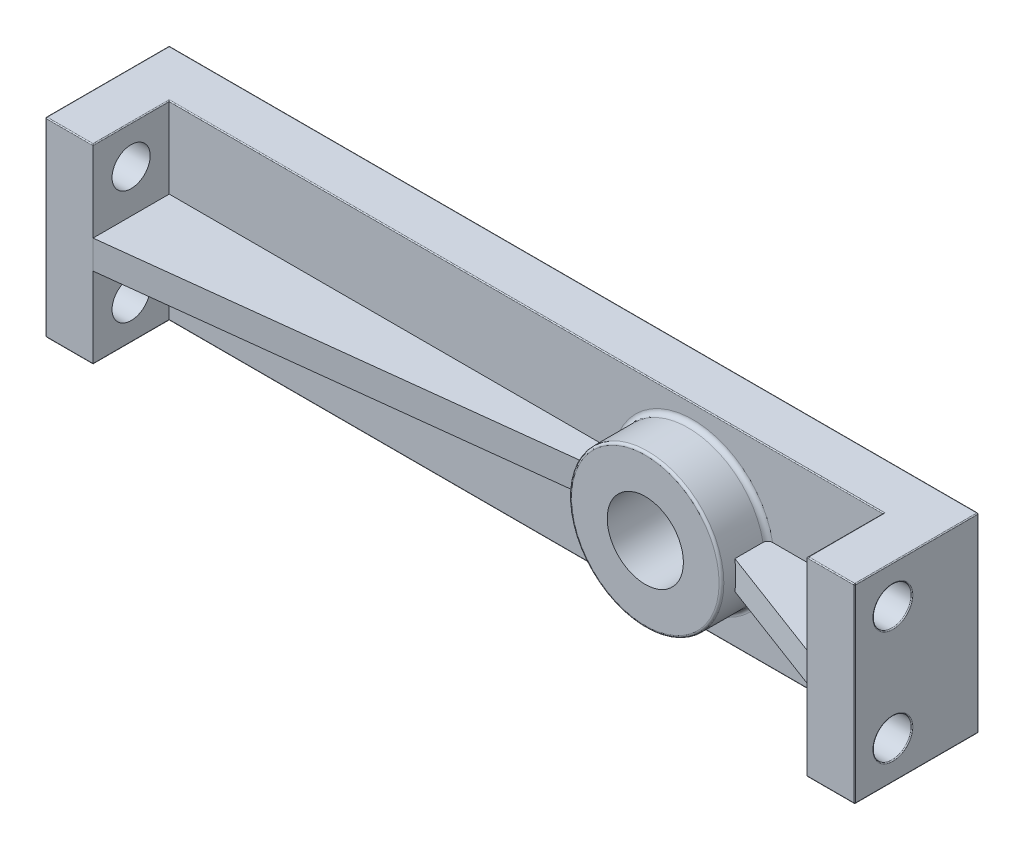
from build123d import *

# Parameters (mm, degrees)
BOSS_EXTRUDE1_DEPTH  = 254
BOSS_EXTRUDE2_DEPTH  = 38.1
SKETCH4_R            = 101.6
CUT_EXTRUDE1_DEPTH   = 1128.442455294
BOSS_EXTRUDE11_REACH = 1129.442
BOSS_EXTRUDE12_REACH = 1129.442
SKETCH12_R           = 101.6
BOSS_EXTRUDE13_DEPTH = 127
CUT_EXTRUDE3_START   = -127
SKETCH19_R           = 50.8
CUT_EXTRUDE3_DEPTH   = 127
SKETCH21_R           = 50.8
CUT_EXTRUDE4_DEPTH   = 127
FILLET1_R            = 2.54
FILLET2_R            = 6.35
FILLET3_R            = 12.7


with BuildPart() as part:
    # Sketch1 → Boss-Extrude1 (new, symmetric)
    with BuildSketch(Plane(origin=(0, 0, 0), x_dir=(1, 0, 0), z_dir=(0, 1, 0))):
        Polygon((-952.5, 0), (952.5, 0), (952.5, -203.2), (1079.5, -203.2), (1079.5, 127), (-1079.5, 127), (-1079.5, -203.2), (-952.5, -203.2), align=None)
    extrude(amount=BOSS_EXTRUDE1_DEPTH, both=True)

    # Sketch2 → Boss-Extrude2 (add, symmetric)
    with BuildSketch(Plane(origin=(0, 0, 0), x_dir=(1, 0, 0), z_dir=(0, 1, 0))):
        Polygon((-952.5, -203.2), (-952.5, 0), (241.3, 0), (241.3, -63.5), align=None)
        Polygon((952.5, 0), (952.5, -203.2), (647.7, -88.9), (647.7, 0), align=None)
    extrude(amount=BOSS_EXTRUDE2_DEPTH, both=True)

    # Sketch4 → Cut-Extrude1 (cut, through all)
    with BuildSketch(Plane.XY):
        with Locations((444.5, 0)):
            Circle(SKETCH4_R)
    extrude(amount=-CUT_EXTRUDE1_DEPTH, mode=Mode.SUBTRACT)

    # Boss-Extrude11: up to this plane
    boss_extrude11_end = Plane(origin=(-952.5, 38.1, 203.2), z_dir=(-0.11622816949504458, 0, -0.9932225393212899))
    # Sketch10 → Boss-Extrude11 (add, up to the surface)
    with BuildSketch(Plane.XY, mode=Mode.PRIVATE) as boss_extrude11_sk1:
        with BuildLine():
            Line((244.903832702, 38.1), (241.3, 38.1))
            Line((241.3, 38.1), (241.3, -8.24e-07))
            ThreePointArc((241.3, -8.24e-07), (242.202964398, 19.135030359), (244.903832702, 38.1))
        make_face()
    boss_extrude11_tool1 = split(extrude(boss_extrude11_sk1.sketch, amount=BOSS_EXTRUDE11_REACH, mode=Mode.PRIVATE), bisect_by=boss_extrude11_end, keep=Keep.BOTH, mode=Mode.PRIVATE)
    add(boss_extrude11_tool1.solids().sort_by_distance((242.379486, 28.591974, 0))[0])
    # Sketch10 → Boss-Extrude11 (add, up to the surface)
    with BuildSketch(Plane.XY, mode=Mode.PRIVATE) as boss_extrude11_sk2:
        with BuildLine():
            ThreePointArc((244.903832702, -38.1), (242.202964476, -19.13503118), (241.3, -8.24e-07))
            Line((241.3, -8.24e-07), (241.3, -38.1))
            Line((241.3, -38.1), (244.903832702, -38.1))
        make_face()
    boss_extrude11_tool2 = split(extrude(boss_extrude11_sk2.sketch, amount=BOSS_EXTRUDE11_REACH, mode=Mode.PRIVATE), bisect_by=boss_extrude11_end, keep=Keep.BOTH, mode=Mode.PRIVATE)
    add(boss_extrude11_tool2.solids().sort_by_distance((242.379486, -28.591974, 0))[0])

    # Boss-Extrude12: up to this plane
    boss_extrude12_end = Plane(origin=(952.5, 38.1, 203.2), z_dir=(0.3511234415883917, 0, -0.9363291775690445))
    # Sketch11 → Boss-Extrude12 (add, up to the surface)
    with BuildSketch(Plane.XY, mode=Mode.PRIVATE) as boss_extrude12_sk1:
        with BuildLine():
            Line((647.7, 0), (647.7, 38.1))
            Line((647.7, 38.1), (644.096167298, 38.1))
            ThreePointArc((644.096167298, 38.1), (646.797035563, 19.135030769), (647.7, 0))
        make_face()
    boss_extrude12_tool1 = split(extrude(boss_extrude12_sk1.sketch, amount=BOSS_EXTRUDE12_REACH, mode=Mode.PRIVATE), bisect_by=boss_extrude12_end, keep=Keep.BOTH, mode=Mode.PRIVATE)
    add(boss_extrude12_tool1.solids().sort_by_distance((646.620514, 28.591974, 0))[0])
    # Sketch11 → Boss-Extrude12 (add, up to the surface)
    with BuildSketch(Plane.XY, mode=Mode.PRIVATE) as boss_extrude12_sk2:
        with BuildLine():
            Line((647.7, -38.1), (647.7, 0))
            ThreePointArc((647.7, 0), (646.797035563, -19.135030769), (644.096167298, -38.1))
            Line((644.096167298, -38.1), (647.7, -38.1))
        make_face()
    boss_extrude12_tool2 = split(extrude(boss_extrude12_sk2.sketch, amount=BOSS_EXTRUDE12_REACH, mode=Mode.PRIVATE), bisect_by=boss_extrude12_end, keep=Keep.BOTH, mode=Mode.PRIVATE)
    add(boss_extrude12_tool2.solids().sort_by_distance((646.620514, -28.591974, 0))[0])

    # Sketch12 → Boss-Extrude13 (add)
    with BuildSketch(Plane.XY):
        with BuildLine():
            ThreePointArc((644.096167298, -38.1), (646.797035563, -19.135030769), (647.7, 0))
            ThreePointArc((647.7, 0), (646.797035563, 19.135030769), (644.096167298, 38.1))
            ThreePointArc((644.096167298, 38.1), (444.5, 203.2), (244.903832702, 38.1))
            ThreePointArc((244.903832702, 38.1), (241.3, 0), (244.903832702, -38.1))
            ThreePointArc((244.903832702, -38.1), (444.5, -203.2), (644.096167298, -38.1))
        make_face()
        with Locations((444.5, 0)):
            Circle(SKETCH12_R, mode=Mode.SUBTRACT)
    extrude(amount=BOSS_EXTRUDE13_DEPTH)

    # Sketch19 → Cut-Extrude3 (cut)
    with BuildSketch(Plane(origin=(1079.5, 0, 0), x_dir=(0, 0, -1), z_dir=(1, 0, 0)).offset(CUT_EXTRUDE3_START)):
        with Locations((-101.6, 152.4)):
            Circle(SKETCH19_R)
        with Locations((-101.6, -152.4)):
            Circle(SKETCH19_R)
    extrude(amount=CUT_EXTRUDE3_DEPTH, mode=Mode.SUBTRACT)

    # Sketch21 → Cut-Extrude4 (cut)
    with BuildSketch(Plane.ZY.offset(1079.5)):
        with Locations(Location((101.6, 152.4, 0), (0, 0, 180))):
            Circle(SKETCH21_R)
        with Locations(Location((101.6, -152.4, 0), (0, 0, 180))):
            Circle(SKETCH21_R)
    extrude(amount=-CUT_EXTRUDE4_DEPTH, mode=Mode.SUBTRACT)

    # Fillet1
    fillet1_edges = [part.edges().sort_by_distance(p)[0] for p in [
        (0, -254, 0),
        (-952.5, -254, 101.6),
        (-1016, -254, 203.2),
        (-1079.5, -254, 38.1),
        (1079.5, 152.4, 152.4),
        (1079.5, -152.4, 152.4),
        (-1079.5, 152.4, 152.4),
        (-1079.5, -152.4, 152.4),
        (-952.5, 254, 101.6),
        (-1079.5, 0, -127),
        (1079.5, 0, -127),
        (1079.5, 0, 203.2),
        (-1079.5, 0, 203.2),
        (0, 254, 0),
        (952.5, 254, 101.6),
        (1016, 254, 203.2),
        (1079.5, 254, 38.1),
        (0, 254, -127),
        (-1079.5, 254, 38.1),
        (342.9, 0, -127),
        (0, -254, -127),
        (-1016, 254, 203.2),
        (1079.5, -254, 38.1),
        (1016, -254, 203.2),
        (952.5, -254, 101.6),
    ]]
    fillet(fillet1_edges, radius=FILLET1_R)

    # Fillet2
    fillet2_edges = [part.edges().sort_by_distance(p)[0] for p in [
        (241.3, 0, 127),
    ]]
    fillet(fillet2_edges, radius=FILLET2_R)

    # Fillet3
    fillet3_edges = [part.edges().sort_by_distance(p)[0] for p in [
        (444.5, -203.2, 0),
        (444.5, 203.2, 0),
    ]]
    fillet(fillet3_edges, radius=FILLET3_R)


solid = part.part
